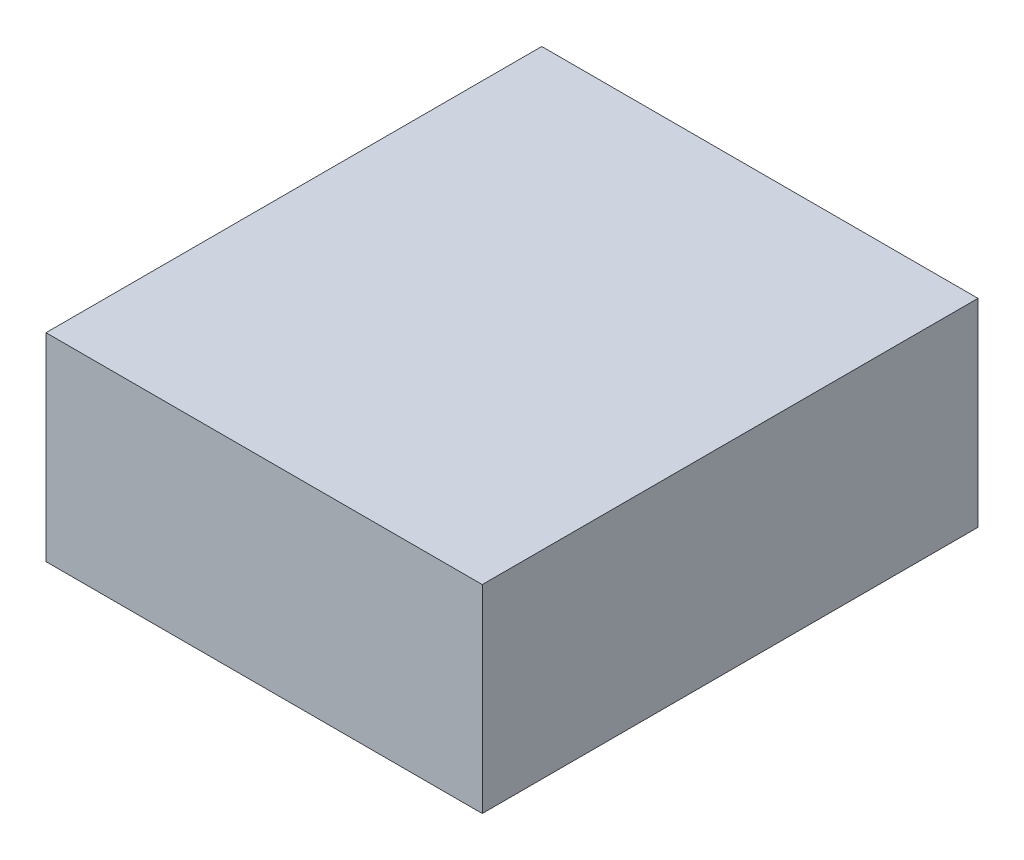
from build123d import *

# Parameters (mm, degrees)
SKETCH1_W           = 220
SKETCH1_H           = 250
BOSS_EXTRUDE1_DEPTH = 100


with BuildPart() as part:
    # Sketch1 → Boss-Extrude1 (new body)
    with BuildSketch(Plane(origin=(0, 0, 0), x_dir=(1, 0, 0), z_dir=(0, 1, 0))):
        Rectangle(SKETCH1_W, SKETCH1_H)
    extrude(amount=BOSS_EXTRUDE1_DEPTH)


solid = part.part
